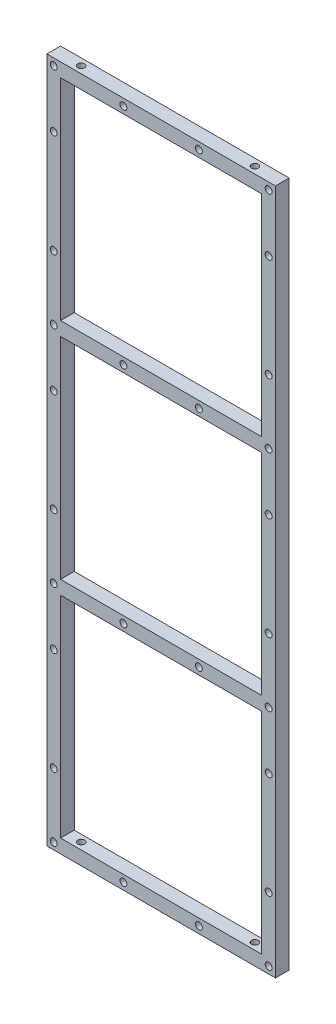
from build123d import *

# Parameters (mm, degrees)
SKETCH1_W           = 100
SKETCH1_H           = 300
SKETCH1_W_2         = 88
SKETCH1_H_2         = 92
BOSS_EXTRUDE1_DEPTH = 6
SKETCH2_R           = 1.5
CUT_EXTRUDE1_DEPTH  = 6
SKETCH3_R           = 1.5
CUT_EXTRUDE2_DEPTH  = 10
SKETCH4_R           = 1.5
CUT_EXTRUDE5_DEPTH  = 10


with BuildPart() as part:
    # Sketch1 → Boss-Extrude1 (new body)
    with BuildSketch(Plane.XY):
        Rectangle(SKETCH1_W, SKETCH1_H)
        with Locations((0, 98)):
            Rectangle(SKETCH1_W_2, SKETCH1_H_2, mode=Mode.SUBTRACT)
        with Locations((0, -98)):
            Rectangle(SKETCH1_W_2, SKETCH1_H_2, mode=Mode.SUBTRACT)
        Rectangle(SKETCH1_W_2, SKETCH1_H_2, mode=Mode.SUBTRACT)
    extrude(amount=BOSS_EXTRUDE1_DEPTH)

    # Sketch2 → Cut-Extrude1 (cut)
    with BuildSketch(Plane.XY.offset(6)):
        with Locations((-47, 147)):
            Circle(SKETCH2_R)
        with Locations((47, 147)):
            Circle(SKETCH2_R)
        with Locations((47, 49)):
            Circle(SKETCH2_R)
        with Locations((47, -49)):
            Circle(SKETCH2_R)
        with Locations((47, -147)):
            Circle(SKETCH2_R)
        with Locations((-47, 49)):
            Circle(SKETCH2_R)
        with Locations((-47, -49)):
            Circle(SKETCH2_R)
        with Locations((-47, -147)):
            Circle(SKETCH2_R)
    extrude(amount=-CUT_EXTRUDE1_DEPTH, mode=Mode.SUBTRACT)

    # Sketch3 → Cut-Extrude2 (cut)
    with BuildSketch(Plane.XY.offset(6)):
        with Locations((-47, -21)):
            Circle(SKETCH3_R)
        with Locations((-16.5, -49)):
            Circle(SKETCH3_R)
        with Locations((-47, -74)):
            Circle(SKETCH3_R)
        with Locations((-47, -119)):
            Circle(SKETCH3_R)
        with Locations((-16.5, -147)):
            Circle(SKETCH3_R)
        with Locations((16.5, -147)):
            Circle(SKETCH3_R)
        with Locations((47, -119)):
            Circle(SKETCH3_R)
        with Locations((47, -74)):
            Circle(SKETCH3_R)
        with Locations((16.5, -49)):
            Circle(SKETCH3_R)
        with Locations((47, -21)):
            Circle(SKETCH3_R)
        with Locations((47, 77)):
            Circle(SKETCH3_R)
        with Locations((16.5, 49)):
            Circle(SKETCH3_R)
        with Locations((-16.5, 147)):
            Circle(SKETCH3_R)
        with Locations((-47, 122)):
            Circle(SKETCH3_R)
        with Locations((16.5, 147)):
            Circle(SKETCH3_R)
        with Locations((-47, 77)):
            Circle(SKETCH3_R)
        with Locations((-16.5, 49)):
            Circle(SKETCH3_R)
        with Locations((-47, 24)):
            Circle(SKETCH3_R)
        with Locations((47, 24)):
            Circle(SKETCH3_R)
        with Locations((47, 122)):
            Circle(SKETCH3_R)
    extrude(amount=-CUT_EXTRUDE2_DEPTH, mode=Mode.SUBTRACT)

    # Sketch4 → Cut-Extrude5 (cut)
    with BuildSketch(Plane(origin=(0, 150, 0), x_dir=(1, 0, 0), z_dir=(0, 1, 0))):
        with Locations(Location((-38, -3, 0), (0, 0, 270))):
            Circle(SKETCH4_R)
        with Locations(Location((38, -3, 0), (0, 0, 90))):
            Circle(SKETCH4_R)
    cut_extrude5 = extrude(amount=-CUT_EXTRUDE5_DEPTH, mode=Mode.SUBTRACT)

    # Mirror1: Cut-Extrude5 across plane
    add(cut_extrude5.mirror(Plane.ZX), mode=Mode.SUBTRACT)


solid = part.part
